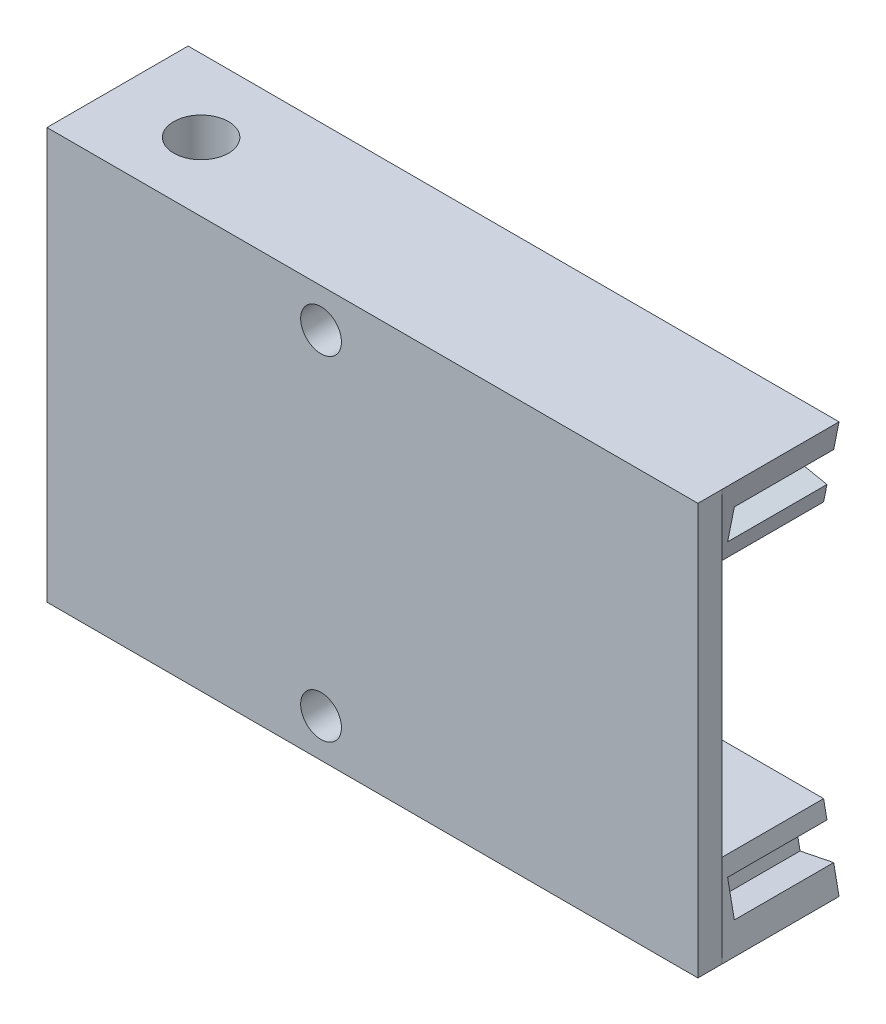
from build123d import *

# Parameters (mm, degrees)
SKETCH1_W           = 15
SKETCH1_H           = 4.12
BOSS_EXTRUDE1_DEPTH = 12
SKETCH3_W           = 3.42
SKETCH3_H           = 7.5
CUT_EXTRUDE1_DEPTH  = 25
CUT_EXTRUDE3_DEPTH  = 3.42
SKETCH7_W           = 2.9
SKETCH7_H           = 1
CUT_EXTRUDE4_DEPTH  = 1
BOSS_EXTRUDE2_DEPTH = 4


with BuildPart() as part:
    # Sketch1 → Boss-Extrude1 (new body)
    with BuildSketch(Plane(origin=(0, 0, 0), x_dir=(1, 0, 0), z_dir=(0, 1, 0))):
        with Locations((7.5, 2.06)):
            Rectangle(SKETCH1_W, SKETCH1_H)
    extrude(amount=BOSS_EXTRUDE1_DEPTH)

    # Sketch3 → Cut-Extrude1 (cut)
    with BuildSketch(Plane.ZY):
        with Locations((-2.41, 6)):
            Rectangle(SKETCH3_W, SKETCH3_H)
    extrude(amount=-CUT_EXTRUDE1_DEPTH, mode=Mode.SUBTRACT)

    # Sketch5 → Cut-Extrude3 (cut)
    with BuildSketch(Plane(origin=(0, 0, -4.12), x_dir=(-1, 0, 0), z_dir=(0, 0, -1))):
        Polygon((-15, 12), (-14.55, 9.75), (-15, 9.75), align=None)
    cut_extrude3 = extrude(amount=-CUT_EXTRUDE3_DEPTH, mode=Mode.SUBTRACT)

    # Mirror2: Cut-Extrude3 across plane
    add(cut_extrude3.mirror(Plane(origin=(0, 6, 0), x_dir=(0, 0, 1), z_dir=(0, -1, 0))), mode=Mode.SUBTRACT)

    # Sketch7 → Cut-Extrude4 (cut)
    with BuildSketch(Plane(origin=(12.115384617, -2.423076922, 0), x_dir=(0, 0, -1), z_dir=(0.9805806757046813, -0.19611613506937897, 0))):
        with Locations((2.67, 13.414151353)):
            Rectangle(SKETCH7_W, SKETCH7_H)
    cut_extrude4 = extrude(amount=-CUT_EXTRUDE4_DEPTH, mode=Mode.SUBTRACT)

    # Sketch10 → #0-80 Tapped Hole1 (revolve, cut)
    with BuildSketch(Plane(origin=(4, 10.875, -4.12), x_dir=(0, 1, 0), z_dir=(1, 0, 0))):
        Polygon((0, 0), (0, 5.307890611), (0.59563, 4.95), (0.59563, 0), align=None)
    f_0_80_tapped_hole1 = revolve(axis=Axis((4, 10.875, -10.47), (0, 0, 1)), mode=Mode.SUBTRACT)

    # Sketch12 → Boss-Extrude2 (add)
    with BuildSketch(Plane.ZY):
        Polygon((0, 0), (0, 12), (-4.12, 12), (-4.12, 9.75), (-0.7, 9.75), (-0.7, 2.25), (-4.12, 2.25), (-4.12, 0), align=None)
    extrude(amount=BOSS_EXTRUDE2_DEPTH)

    # Sketch15 → M2x0.4 Tapped Hole1 (revolve, cut)
    with BuildSketch(Plane(origin=(-1.5, 12, -2), x_dir=(0, 0, 1), z_dir=(1, 0, 0))):
        Polygon((0, 0), (0, 5.680688495), (0.8, 5.2), (0.8, 0), align=None)
    m2x0_4_tapped_hole1 = revolve(axis=Axis((-1.5, 18.35, -2), (0, -1, 0)), mode=Mode.SUBTRACT)

    # Mirror3: Cut-Extrude4, #0-80 Tapped Hole1, M2x0.4 Tapped Hole1 across plane
    add(cut_extrude4.mirror(Plane(origin=(0, 6, 0), x_dir=(0, 0, 1), z_dir=(0, -1, 0))), mode=Mode.SUBTRACT)
    add(f_0_80_tapped_hole1.mirror(Plane(origin=(0, 6, 0), x_dir=(0, 0, 1), z_dir=(0, -1, 0))), mode=Mode.SUBTRACT)
    add(m2x0_4_tapped_hole1.mirror(Plane(origin=(0, 6, 0), x_dir=(0, 0, 1), z_dir=(0, -1, 0))), mode=Mode.SUBTRACT)


solid = part.part
